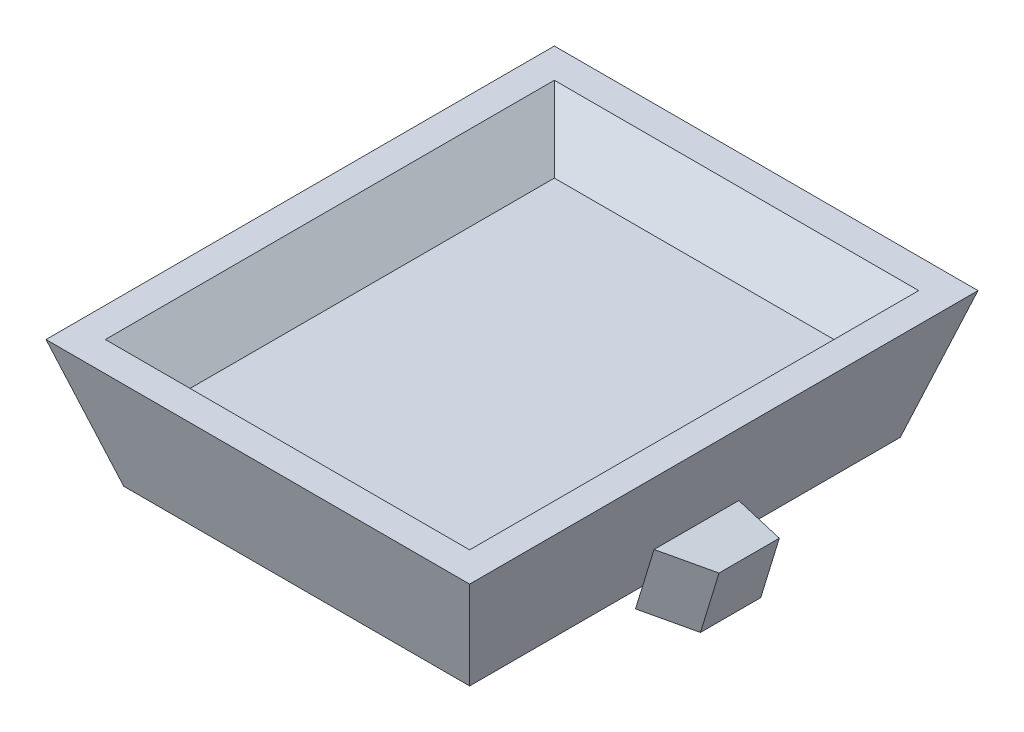
from build123d import *

# Parameters (mm, degrees)
SKETCH1_W           = 100
SKETCH1_H           = 120
BOSS_EXTRUDE1_DEPTH = 30
BOSS_EXTRUDE1_DRAFT = -17
SKETCH2_W           = 86
SKETCH2_H           = 106
CUT_EXTRUDE1_DEPTH  = 10
SKETCH3_W           = 20
SKETCH3_H           = 15
BOSS_EXTRUDE2_DEPTH = 10
DRAFT1_ANGLE        = 45
DRAFT2_ANGLE        = 30


with BuildPart() as part:
    # Sketch1 → Boss-Extrude1 (with draft: the straight prism first)
    with BuildSketch(Plane(origin=(0, 0, 0), x_dir=(1, 0, 0), z_dir=(0, 1, 0))):
        Rectangle(SKETCH1_W, SKETCH1_H)
    extrude(amount=-BOSS_EXTRUDE1_DEPTH)
    # Boss-Extrude1: the draft: its side faces are tilted about the plane it starts from
    boss_extrude1_sides = [part.faces().sort_by_distance(p)[0] for p in [
        (-50, -15, 0),
        (0, -15, 60),
        (50, -15, 0),
        (0, -15, -60),
    ]]
    draft(boss_extrude1_sides, Plane(origin=(0, 0, 0), x_dir=(1, 0, 0), z_dir=(0, 1, 0)), BOSS_EXTRUDE1_DRAFT)

    # Sketch2 → Cut-Extrude1 (cut)
    with BuildSketch(Plane(origin=(0, 0, 0), x_dir=(1, 0, 0), z_dir=(0, 1, 0))):
        Rectangle(SKETCH2_W, SKETCH2_H)
    extrude(amount=-CUT_EXTRUDE1_DEPTH, mode=Mode.SUBTRACT)

    # Sketch3 → Boss-Extrude2 (add)
    with BuildSketch(Plane(origin=(45.725939314, -13.979822587, 0), x_dir=(0, 0, -1), z_dir=(0.9563047559630354, -0.2923717047227369, 0))):
        with Locations((0, -15)):
            Rectangle(SKETCH3_W, SKETCH3_H)
    extrude(amount=BOSS_EXTRUDE2_DEPTH)

    # Draft1
    draft1_faces = [part.faces().sort_by_distance(p)[0] for p in [
        (0, -5, 53),
        (43, -5, 0),
        (0, -5, -53),
        (-43, -5, 0),
    ]]
    draft(draft1_faces, Plane.ZX, DRAFT1_ANGLE)

    # Draft2
    draft2_faces = [part.faces().sort_by_distance(p)[0] for p in [
        (46.121887523, -29.78625245, 10),
    ]]
    draft(draft2_faces, Plane(origin=(50, 0, -60), x_dir=(0.2923717047227369, 0.9563047559630354, 0), z_dir=(0.9563047559630354, -0.2923717047227369, 0)), DRAFT2_ANGLE)


solid = part.part
